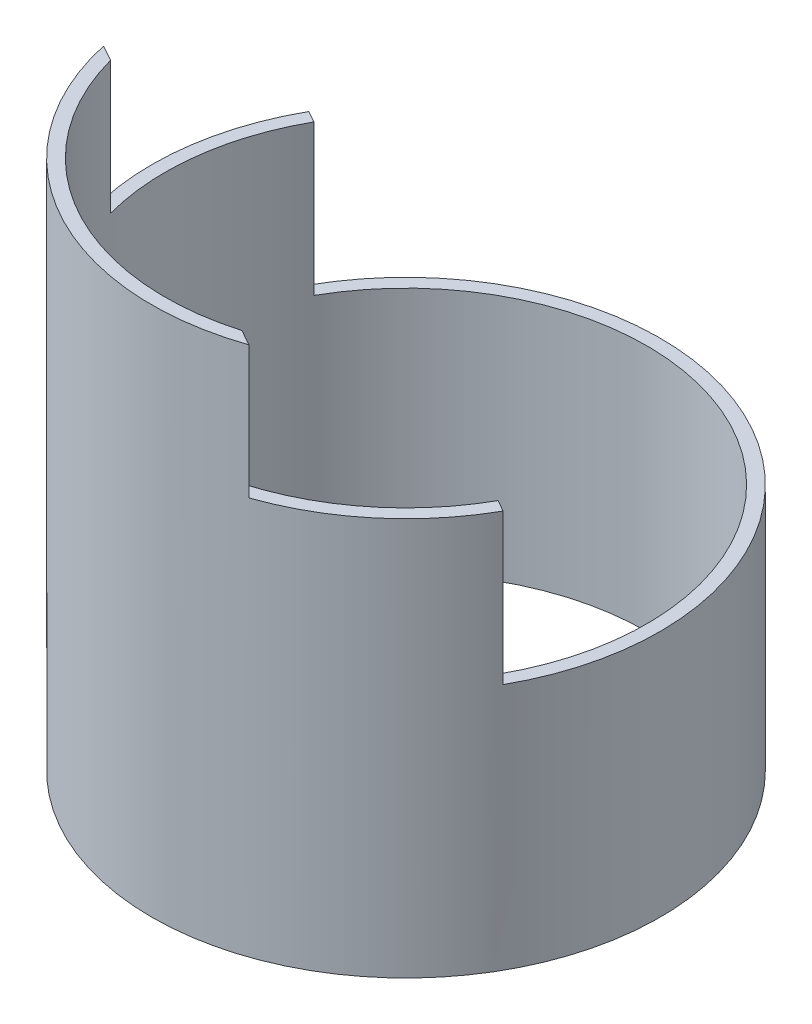
from build123d import *

# Parameters (mm, degrees)
SKETCH1_R           = 57.5
SKETCH1_R_2         = 54.5
BOSS_EXTRUDE1_DEPTH = 120
SKETCH4_OUTSIDE_W   = 157.422
SKETCH4_OUTSIDE_H   = 157.422
CUT_EXTRUDE1_DEPTH  = 64
SKETCH5_OUTSIDE_W   = 157.422
SKETCH5_OUTSIDE_H   = 157.422
CUT_EXTRUDE2_DEPTH  = 30


with BuildPart() as part:
    # Sketch1 → Boss-Extrude1 (new body)
    with BuildSketch(Plane(origin=(0, 0, 0), x_dir=(1, 0, 0), z_dir=(0, 1, 0))):
        with Locations(Location((0, 0, 0), (0, 0, 270))):
            Circle(SKETCH1_R)
        with Locations(Location((0, 0, 0), (0, 0, 270))):
            Circle(SKETCH1_R_2, mode=Mode.SUBTRACT)
    extrude(amount=BOSS_EXTRUDE1_DEPTH)

    # Sketch4 outside → Cut-Extrude1 (cut)
    with BuildSketch(Plane(origin=(0, 120, 0), x_dir=(1, 0, 0), z_dir=(0, 1, 0))):
        Rectangle(SKETCH4_OUTSIDE_W, SKETCH4_OUTSIDE_H)
        with BuildLine():
            Line((-50.133042419, 28.158978281), (50.133042419, -28.158978281))
            ThreePointArc((50.133042419, -28.158978281), (-28.158978281, -50.133042419), (-50.133042419, 28.158978281))
        make_face(mode=Mode.SUBTRACT)
    extrude(amount=-CUT_EXTRUDE1_DEPTH, mode=Mode.SUBTRACT)

    # Sketch5 outside → Cut-Extrude2 (cut)
    with BuildSketch(Plane(origin=(0, 120, 0), x_dir=(1, 0, 0), z_dir=(0, 1, 0))):
        Rectangle(SKETCH5_OUTSIDE_W, SKETCH5_OUTSIDE_H)
        with BuildLine():
            Line((-56.185392762, -12.22504152), (18.796201116, -54.341078602))
            ThreePointArc((18.796201116, -54.341078602), (-28.158978281, -50.133042419), (-56.185392762, -12.22504152))
        make_face(mode=Mode.SUBTRACT)
    extrude(amount=-CUT_EXTRUDE2_DEPTH, mode=Mode.SUBTRACT)


solid = part.part
